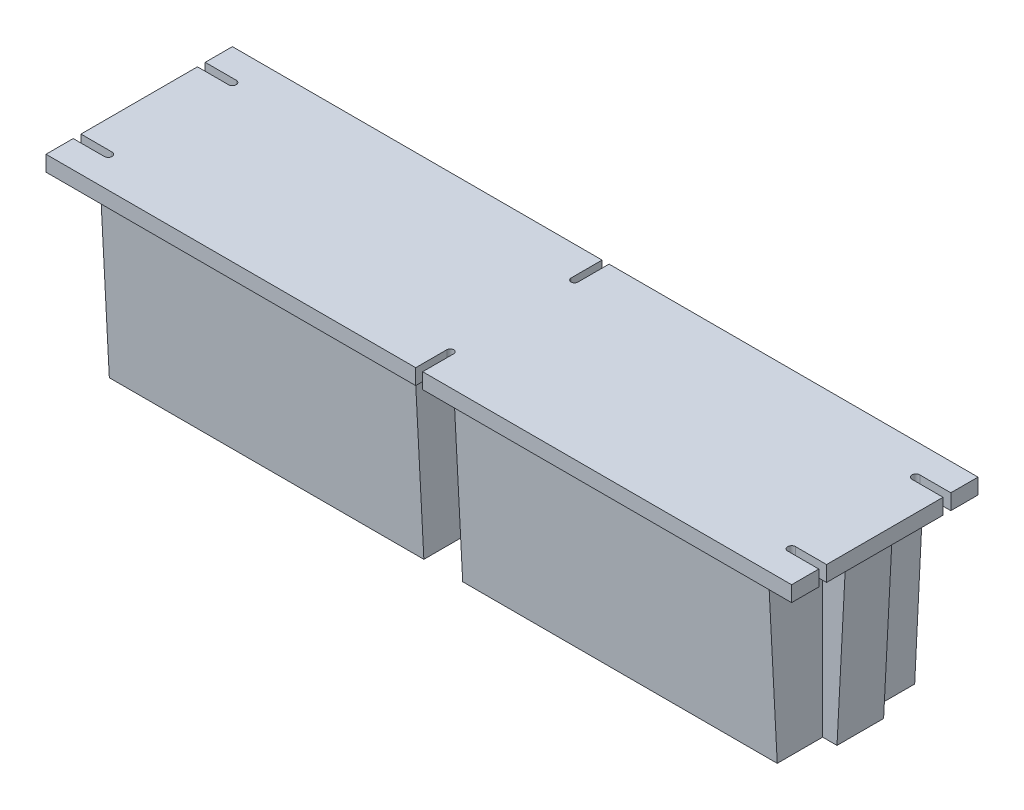
from build123d import *

# Parameters (mm, degrees)
SKETCH1_W           = 1219.2
SKETCH1_H           = 304.8
BOSS_EXTRUDE1_DEPTH = 304.8
CUT_EXTRUDE1_DEPTH  = 1294.156881434
CUT_EXTRUDE2_DEPTH  = 1294.156881434
CUT_EXTRUDE4_DEPTH  = 1294.156881434
SKETCH7_W           = 63.5
SKETCH7_H           = 279.4
CUT_EXTRUDE5_DEPTH  = 114.3


with BuildPart() as part:
    # Sketch1 → Boss-Extrude1 (new body)
    with BuildSketch(Plane(origin=(0, 0, 0), x_dir=(1, 0, 0), z_dir=(0, 1, 0))):
        with Locations((609.6, 152.4)):
            Rectangle(SKETCH1_W, SKETCH1_H)
    extrude(amount=-BOSS_EXTRUDE1_DEPTH)

    # Sketch2 → Cut-Extrude1 (cut, through all)
    with BuildSketch(Plane(origin=(0, 0, 0), x_dir=(1, 0, 0), z_dir=(0, 1, 0))):
        with BuildLine():
            Line((0, 260.35), (50.8, 260.35))
            ThreePointArc((50.8, 260.35), (57.15, 254), (50.8, 247.65))
            Line((50.8, 247.65), (0, 247.65))
            Line((0, 247.65), (0, 260.35))
        make_face()
        with BuildLine():
            Line((0, 57.15), (50.8, 57.15))
            ThreePointArc((50.8, 57.15), (57.15, 50.8), (50.8, 44.45))
            Line((50.8, 44.45), (0, 44.45))
            Line((0, 44.45), (0, 57.15))
        make_face()
        with BuildLine():
            Line((1219.2, 57.15), (1219.2, 44.45))
            Line((1219.2, 44.45), (1168.4, 44.45))
            ThreePointArc((1168.4, 44.45), (1162.05, 50.8), (1168.4, 57.15))
            Line((1168.4, 57.15), (1219.2, 57.15))
        make_face()
        with BuildLine():
            Line((1219.2, 260.35), (1219.2, 247.65))
            Line((1219.2, 247.65), (1168.4, 247.65))
            ThreePointArc((1168.4, 247.65), (1162.05, 254), (1168.4, 260.35))
            Line((1168.4, 260.35), (1219.2, 260.35))
        make_face()
        with BuildLine():
            Line((604.52, 304.8), (604.52, 254))
            ThreePointArc((604.52, 254), (610.235, 248.285), (615.95, 254))
            Line((615.95, 254), (615.95, 304.8))
            Line((615.95, 304.8), (604.52, 304.8))
        make_face()
        with BuildLine():
            Line((615.95, 0), (615.95, 50.8))
            ThreePointArc((615.95, 50.8), (610.235, 56.515), (604.52, 50.8))
            Line((604.52, 50.8), (604.52, 0))
            Line((604.52, 0), (615.95, 0))
        make_face()
    extrude(amount=-CUT_EXTRUDE1_DEPTH, mode=Mode.SUBTRACT)

    # Sketch4 → Cut-Extrude2 (cut, through all)
    with BuildSketch(Plane.ZY):
        Polygon((-304.8, -25.4), (-279.4, -25.4), (-264.757266468, -304.8), (-304.8, -304.8), align=None)
        Polygon((-40.042733532, -304.8), (-25.4, -25.4), (0, -25.4), (0, -304.8), align=None)
    extrude(amount=-CUT_EXTRUDE2_DEPTH, mode=Mode.SUBTRACT)

    # Sketch6 → Cut-Extrude4 (cut, through all)
    with BuildSketch(Plane.XY):
        Polygon((0, -25.4), (25.375259462, -25.4), (40.03808789, -304.8), (0, -304.8), align=None)
        Polygon((1193.8, -25.4), (1219.2, -25.4), (1219.2, -304.8), (1179.137171572, -304.8), align=None)
    extrude(amount=-CUT_EXTRUDE4_DEPTH, mode=Mode.SUBTRACT)

    # Sketch7 → Cut-Extrude5 (cut)
    with BuildSketch(Plane.XY):
        with Locations((1187.45, -165.1)):
            Rectangle(SKETCH7_W, SKETCH7_H)
        with Locations((31.75, -165.1)):
            Rectangle(SKETCH7_W, SKETCH7_H)
        with Locations((609.6, -165.1)):
            Rectangle(SKETCH7_W, SKETCH7_H)
    cut_extrude5 = extrude(amount=-CUT_EXTRUDE5_DEPTH, mode=Mode.SUBTRACT)

    # Mirror1: Cut-Extrude5 across plane
    add(cut_extrude5.mirror(Plane(origin=(0, 0, -152.4), x_dir=(1, 0, 0), z_dir=(0, 0, -1))), mode=Mode.SUBTRACT)


solid = part.part
